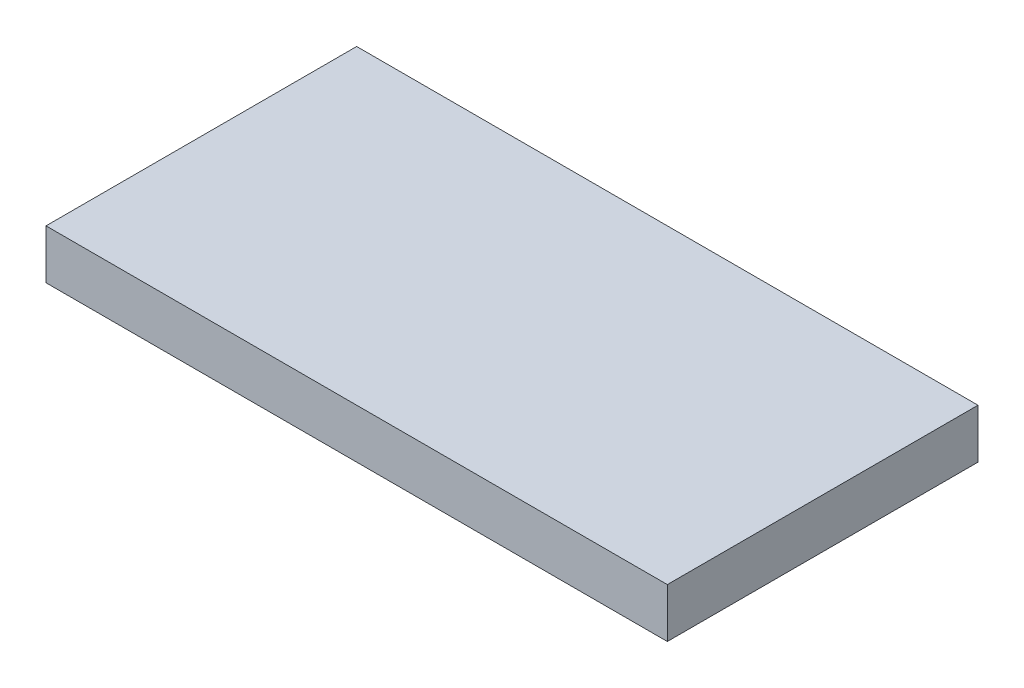
from build123d import *

# Parameters (mm, degrees)
SKETCH1_W           = 80
SKETCH1_H           = 40
BOSS_EXTRUDE1_DEPTH = 6.35


with BuildPart() as part:
    # Sketch1 → Boss-Extrude1 (new body)
    with BuildSketch(Plane(origin=(0, 0, 0), x_dir=(1, 0, 0), z_dir=(0, 1, 0))):
        with Locations((40, 20)):
            Rectangle(SKETCH1_W, SKETCH1_H)
    extrude(amount=BOSS_EXTRUDE1_DEPTH)


solid = part.part
